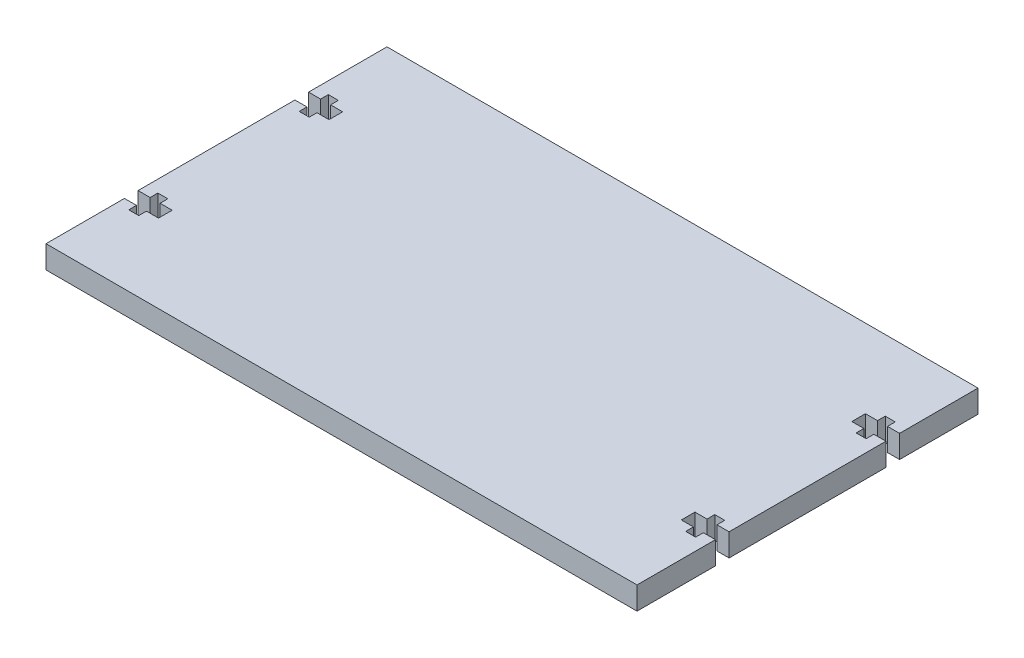
from build123d import *

# Parameters (mm, degrees)
SKETCH1_W            = 165.1
SKETCH1_H            = 95.25
BOSS_EXTRUDE1_DEPTH  = 6.35
CUT_EXTRUDE2_DEPTH   = 96.514216874
MIRROR2_COPY_1_DEPTH = 96.514216874


with BuildPart() as part:
    # Sketch1 → Boss-Extrude1 (new body)
    with BuildSketch(Plane(origin=(0, 0, 0), x_dir=(1, 0, 0), z_dir=(0, 1, 0))):
        Rectangle(SKETCH1_W, SKETCH1_H)
    extrude(amount=BOSS_EXTRUDE1_DEPTH)

    # Sketch2 → Cut-Extrude2 (cut, through all)
    with BuildSketch(Plane(origin=(0, 6.35, 0), x_dir=(1, 0, 0), z_dir=(0, 1, 0))):
        Polygon((82.55, -21.9075), (79.1845, -21.9075), (79.1845, -19.7485), (76.3905, -19.7485), (76.3905, -21.9075), (73.025, -21.9075), (73.025, -25.7175), (76.3905, -25.7175), (76.3905, -27.8765), (79.1845, -27.8765), (79.1845, -25.7175), (82.55, -25.7175), align=None)
    cut_extrude2 = extrude(amount=-CUT_EXTRUDE2_DEPTH, mode=Mode.SUBTRACT)

    # Mirror1: Cut-Extrude2 across plane
    add(cut_extrude2.mirror(Plane.XY), mode=Mode.SUBTRACT)

    # Mirror2: Cut-Extrude2 across plane
    add(cut_extrude2.mirror(Plane(origin=(0, 0, 0), x_dir=(0, 0, 1), z_dir=(1, 0, 0))), mode=Mode.SUBTRACT)

    # Mirror2 copy 1 sketch → Mirror2 copy 1 (cut, through all)
    with BuildSketch(Plane(origin=(0, 6.35, 0), x_dir=(-1, 0, 0), z_dir=(0, 1, 0))):
        Polygon((82.55, -21.9075), (79.1845, -21.9075), (79.1845, -19.7485), (76.3905, -19.7485), (76.3905, -21.9075), (73.025, -21.9075), (73.025, -25.7175), (76.3905, -25.7175), (76.3905, -27.8765), (79.1845, -27.8765), (79.1845, -25.7175), (82.55, -25.7175), align=None)
    extrude(amount=-MIRROR2_COPY_1_DEPTH, mode=Mode.SUBTRACT)


solid = part.part
